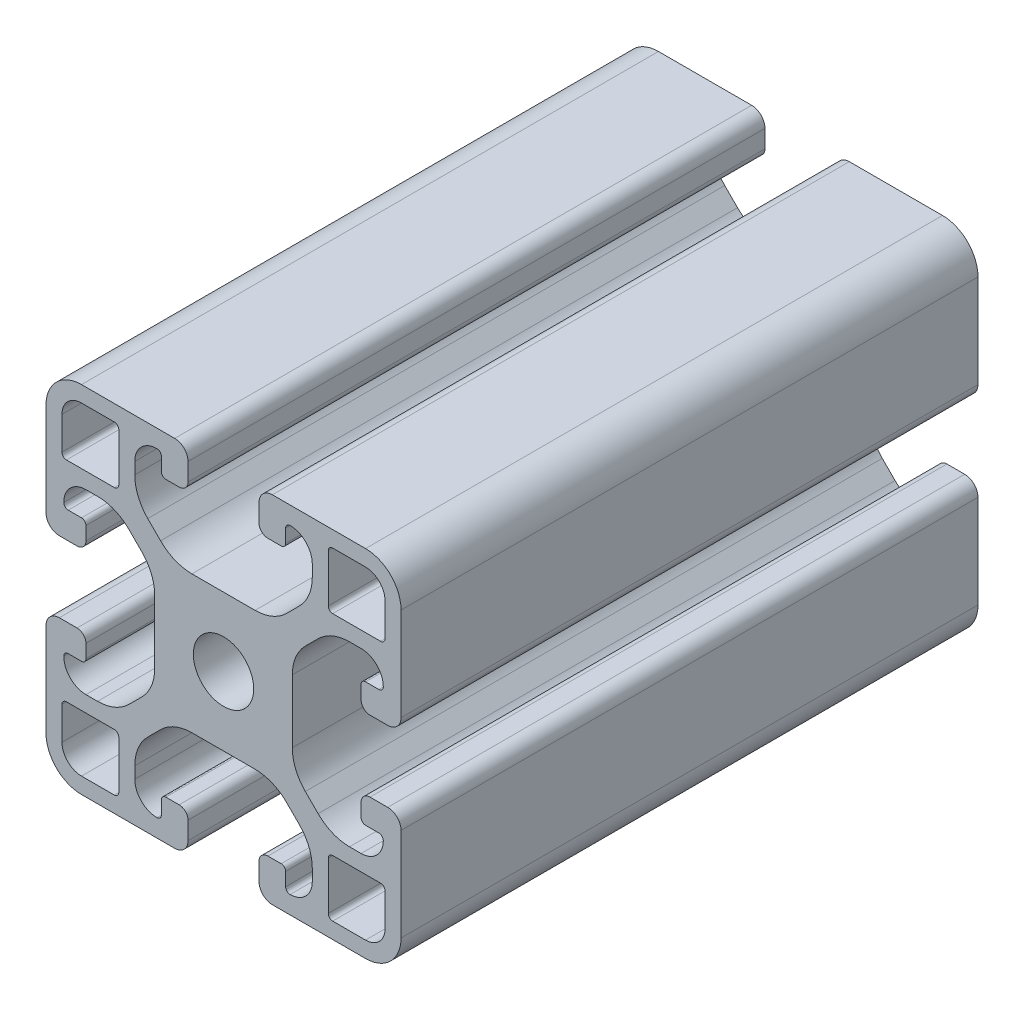
from build123d import *

# Parameters (mm, degrees)
ESQUISSE1_R        = 3.4
BOSS_EXTRU_1_DEPTH = 65


with BuildPart() as part:
    # Esquisse1 → Boss.-Extru.1 (new body)
    with BuildSketch(Plane(origin=(0, 0, -30), x_dir=(-1, 0, 0), z_dir=(0, 0, -1))):
        with BuildLine():
            Line((-4.5, 15), (-4.5, 13.5))
            ThreePointArc((-4.5, 13.5), (-4.353553391, 13.146446609), (-4, 13))
            Line((-4, 13), (-2.5, 13))
            ThreePointArc((-2.5, 13), (-2.146446609, 12.853553391), (-2, 12.5))
            ThreePointArc((-2, 12.5), (-2.732233047, 10.732233047), (-4.5, 10))
            Line((-4.5, 10), (-5.807611845, 10))
            ThreePointArc((-5.807611845, 10), (-7.721029006, 10.380602337), (-9.343145751, 11.464466094))
            Line((-9.343145751, 11.464466094), (-10.785533906, 12.906854249))
            ThreePointArc((-10.785533906, 12.906854249), (-11.869397663, 14.528970994), (-12.25, 16.442388155))
            Line((-12.25, 16.442388155), (-12.25, 23.557611845))
            ThreePointArc((-12.25, 23.557611845), (-11.869397663, 25.471029006), (-10.785533906, 27.093145751))
            Line((-10.785533906, 27.093145751), (-9.343145751, 28.535533906))
            ThreePointArc((-9.343145751, 28.535533906), (-7.721029006, 29.619397663), (-5.807611845, 30))
            Line((-5.807611845, 30), (-4.5, 30))
            ThreePointArc((-4.5, 30), (-2.732233047, 29.267766953), (-2, 27.5))
            ThreePointArc((-2, 27.5), (-2.146446609, 27.146446609), (-2.5, 27))
            Line((-2.5, 27), (-4, 27))
            ThreePointArc((-4, 27), (-4.353553391, 26.853553391), (-4.5, 26.5))
            Line((-4.5, 26.5), (-4.5, 25))
            ThreePointArc((-4.5, 25), (-4.207106781, 24.292893219), (-3.5, 24))
            Line((-3.5, 24), (-1.5, 24))
            ThreePointArc((-1.5, 24), (-0.439339828, 24.439339828), (0, 25.5))
            Line((0, 25.5), (0, 36))
            ThreePointArc((0, 36), (-1.171572875, 38.828427125), (-4, 40))
            Line((-4, 40), (-14.5, 40))
            ThreePointArc((-14.5, 40), (-15.560660172, 39.560660172), (-16, 38.5))
            Line((-16, 38.5), (-16, 36.5))
            ThreePointArc((-16, 36.5), (-15.707106781, 35.792893219), (-15, 35.5))
            Line((-15, 35.5), (-13.5, 35.5))
            ThreePointArc((-13.5, 35.5), (-13.146446609, 35.646446609), (-13, 36))
            Line((-13, 36), (-13, 37.5))
            ThreePointArc((-13, 37.5), (-12.853553391, 37.853553391), (-12.5, 38))
            ThreePointArc((-12.5, 38), (-10.732233047, 37.267766953), (-10, 35.5))
            Line((-10, 35.5), (-10, 34.192388155))
            ThreePointArc((-10, 34.192388155), (-10.380602337, 32.278970994), (-11.464466094, 30.656854249))
            Line((-11.464466094, 30.656854249), (-12.906854249, 29.214466094))
            ThreePointArc((-12.906854249, 29.214466094), (-14.528970994, 28.130602337), (-16.442388155, 27.75))
            Line((-16.442388155, 27.75), (-23.557611845, 27.75))
            ThreePointArc((-23.557611845, 27.75), (-25.471029006, 28.130602337), (-27.093145751, 29.214466094))
            Line((-27.093145751, 29.214466094), (-28.535533906, 30.656854249))
            ThreePointArc((-28.535533906, 30.656854249), (-29.619397663, 32.278970994), (-30, 34.192388155))
            Line((-30, 34.192388155), (-30, 35.5))
            ThreePointArc((-30, 35.5), (-29.267766953, 37.267766953), (-27.5, 38))
            ThreePointArc((-27.5, 38), (-27.146446609, 37.853553391), (-27, 37.5))
            Line((-27, 37.5), (-27, 36))
            ThreePointArc((-27, 36), (-26.853553391, 35.646446609), (-26.5, 35.5))
            Line((-26.5, 35.5), (-25, 35.5))
            ThreePointArc((-25, 35.5), (-24.292893219, 35.792893219), (-24, 36.5))
            Line((-24, 36.5), (-24, 38.5))
            ThreePointArc((-24, 38.5), (-24.439339828, 39.560660172), (-25.5, 40))
            Line((-25.5, 40), (-36, 40))
            ThreePointArc((-36, 40), (-38.828427125, 38.828427125), (-40, 36))
            Line((-40, 36), (-40, 25.5))
            ThreePointArc((-40, 25.5), (-39.560660172, 24.439339828), (-38.5, 24))
            Line((-38.5, 24), (-36.5, 24))
            ThreePointArc((-36.5, 24), (-35.792893219, 24.292893219), (-35.5, 25))
            Line((-35.5, 25), (-35.5, 26.5))
            ThreePointArc((-35.5, 26.5), (-35.646446609, 26.853553391), (-36, 27))
            Line((-36, 27), (-37.5, 27))
            ThreePointArc((-37.5, 27), (-37.853553391, 27.146446609), (-38, 27.5))
            ThreePointArc((-38, 27.5), (-37.267766953, 29.267766953), (-35.5, 30))
            Line((-35.5, 30), (-34.192388155, 30))
            ThreePointArc((-34.192388155, 30), (-32.278970994, 29.619397663), (-30.656854249, 28.535533906))
            Line((-30.656854249, 28.535533906), (-29.214466094, 27.093145751))
            ThreePointArc((-29.214466094, 27.093145751), (-28.130602337, 25.471029006), (-27.75, 23.557611845))
            Line((-27.75, 23.557611845), (-27.75, 16.442388155))
            ThreePointArc((-27.75, 16.442388155), (-28.130602337, 14.528970994), (-29.214466094, 12.906854249))
            Line((-29.214466094, 12.906854249), (-30.656854249, 11.464466094))
            ThreePointArc((-30.656854249, 11.464466094), (-32.278970994, 10.380602337), (-34.192388155, 10))
            Line((-34.192388155, 10), (-35.5, 10))
            ThreePointArc((-35.5, 10), (-37.267766953, 10.732233047), (-38, 12.5))
            ThreePointArc((-38, 12.5), (-37.853553391, 12.853553391), (-37.5, 13))
            Line((-37.5, 13), (-36, 13))
            ThreePointArc((-36, 13), (-35.646446609, 13.146446609), (-35.5, 13.5))
            Line((-35.5, 13.5), (-35.5, 15))
            ThreePointArc((-35.5, 15), (-35.792893219, 15.707106781), (-36.5, 16))
            Line((-36.5, 16), (-38.5, 16))
            ThreePointArc((-38.5, 16), (-39.560660172, 15.560660172), (-40, 14.5))
            Line((-40, 14.5), (-40, 4))
            ThreePointArc((-40, 4), (-38.828427125, 1.171572875), (-36, 0))
            Line((-36, 0), (-25.5, 0))
            ThreePointArc((-25.5, 0), (-24.439339828, 0.439339828), (-24, 1.5))
            Line((-24, 1.5), (-24, 3.5))
            ThreePointArc((-24, 3.5), (-24.292893219, 4.207106781), (-25, 4.5))
            Line((-25, 4.5), (-26.5, 4.5))
            ThreePointArc((-26.5, 4.5), (-26.853553391, 4.353553391), (-27, 4))
            Line((-27, 4), (-27, 2.5))
            ThreePointArc((-27, 2.5), (-27.146446609, 2.146446609), (-27.5, 2))
            ThreePointArc((-27.5, 2), (-29.267766953, 2.732233047), (-30, 4.5))
            Line((-30, 4.5), (-30, 5.807611845))
            ThreePointArc((-30, 5.807611845), (-29.619397663, 7.721029006), (-28.535533906, 9.343145751))
            Line((-28.535533906, 9.343145751), (-27.093145751, 10.785533906))
            ThreePointArc((-27.093145751, 10.785533906), (-25.471029006, 11.869397663), (-23.557611845, 12.25))
            Line((-23.557611845, 12.25), (-16.442388155, 12.25))
            ThreePointArc((-16.442388155, 12.25), (-14.528970994, 11.869397663), (-12.906854249, 10.785533906))
            Line((-12.906854249, 10.785533906), (-11.464466094, 9.343145751))
            ThreePointArc((-11.464466094, 9.343145751), (-10.380602337, 7.721029006), (-10, 5.807611845))
            Line((-10, 5.807611845), (-10, 4.5))
            ThreePointArc((-10, 4.5), (-10.732233047, 2.732233047), (-12.5, 2))
            ThreePointArc((-12.5, 2), (-12.853553391, 2.146446609), (-13, 2.5))
            Line((-13, 2.5), (-13, 4))
            ThreePointArc((-13, 4), (-13.146446609, 4.353553391), (-13.5, 4.5))
            Line((-13.5, 4.5), (-15, 4.5))
            ThreePointArc((-15, 4.5), (-15.707106781, 4.207106781), (-16, 3.5))
            Line((-16, 3.5), (-16, 1.5))
            ThreePointArc((-16, 1.5), (-15.560660172, 0.439339828), (-14.5, 0))
            Line((-14.5, 0), (-4, 0))
            ThreePointArc((-4, 0), (-1.171572875, 1.171572875), (0, 4))
            Line((0, 4), (0, 14.5))
            ThreePointArc((0, 14.5), (-0.439339828, 15.560660172), (-1.5, 16))
            Line((-1.5, 16), (-3.5, 16))
            ThreePointArc((-3.5, 16), (-4.207106781, 15.707106781), (-4.5, 15))
        make_face()
        with Locations(Location((-20, 20, 0), (0, 0, 180))):
            Circle(ESQUISSE1_R, mode=Mode.SUBTRACT)
        with BuildLine():
            Line((-4, 1.8), (-7.7, 1.8))
            ThreePointArc((-7.7, 1.8), (-8.053553391, 1.946446609), (-8.2, 2.3))
            Line((-8.2, 2.3), (-8.2, 7.7))
            ThreePointArc((-8.2, 7.7), (-8.053553391, 8.053553391), (-7.7, 8.2))
            Line((-7.7, 8.2), (-2.3, 8.2))
            ThreePointArc((-2.3, 8.2), (-1.946446609, 8.053553391), (-1.8, 7.7))
            Line((-1.8, 7.7), (-1.8, 4))
            ThreePointArc((-1.8, 4), (-2.444365081, 2.444365081), (-4, 1.8))
        make_face(mode=Mode.SUBTRACT)
        with BuildLine():
            Line((-38.2, 4), (-38.2, 7.7))
            ThreePointArc((-38.2, 7.7), (-38.053553391, 8.053553391), (-37.7, 8.2))
            Line((-37.7, 8.2), (-32.3, 8.2))
            ThreePointArc((-32.3, 8.2), (-31.946446609, 8.053553391), (-31.8, 7.7))
            Line((-31.8, 7.7), (-31.8, 2.3))
            ThreePointArc((-31.8, 2.3), (-31.946446609, 1.946446609), (-32.3, 1.8))
            Line((-32.3, 1.8), (-36, 1.8))
            ThreePointArc((-36, 1.8), (-37.555634919, 2.444365081), (-38.2, 4))
        make_face(mode=Mode.SUBTRACT)
        with BuildLine():
            Line((-36, 38.2), (-32.3, 38.2))
            ThreePointArc((-32.3, 38.2), (-31.946446609, 38.053553391), (-31.8, 37.7))
            Line((-31.8, 37.7), (-31.8, 32.3))
            ThreePointArc((-31.8, 32.3), (-31.946446609, 31.946446609), (-32.3, 31.8))
            Line((-32.3, 31.8), (-37.7, 31.8))
            ThreePointArc((-37.7, 31.8), (-38.053553391, 31.946446609), (-38.2, 32.3))
            Line((-38.2, 32.3), (-38.2, 36))
            ThreePointArc((-38.2, 36), (-37.555634919, 37.555634919), (-36, 38.2))
        make_face(mode=Mode.SUBTRACT)
        with BuildLine():
            Line((-1.8, 36), (-1.8, 32.3))
            ThreePointArc((-1.8, 32.3), (-1.946446609, 31.946446609), (-2.3, 31.8))
            Line((-2.3, 31.8), (-7.7, 31.8))
            ThreePointArc((-7.7, 31.8), (-8.053553391, 31.946446609), (-8.2, 32.3))
            Line((-8.2, 32.3), (-8.2, 37.7))
            ThreePointArc((-8.2, 37.7), (-8.053553391, 38.053553391), (-7.7, 38.2))
            Line((-7.7, 38.2), (-4, 38.2))
            ThreePointArc((-4, 38.2), (-2.444365081, 37.555634919), (-1.8, 36))
        make_face(mode=Mode.SUBTRACT)
    extrude(amount=-BOSS_EXTRU_1_DEPTH)


solid = part.part
